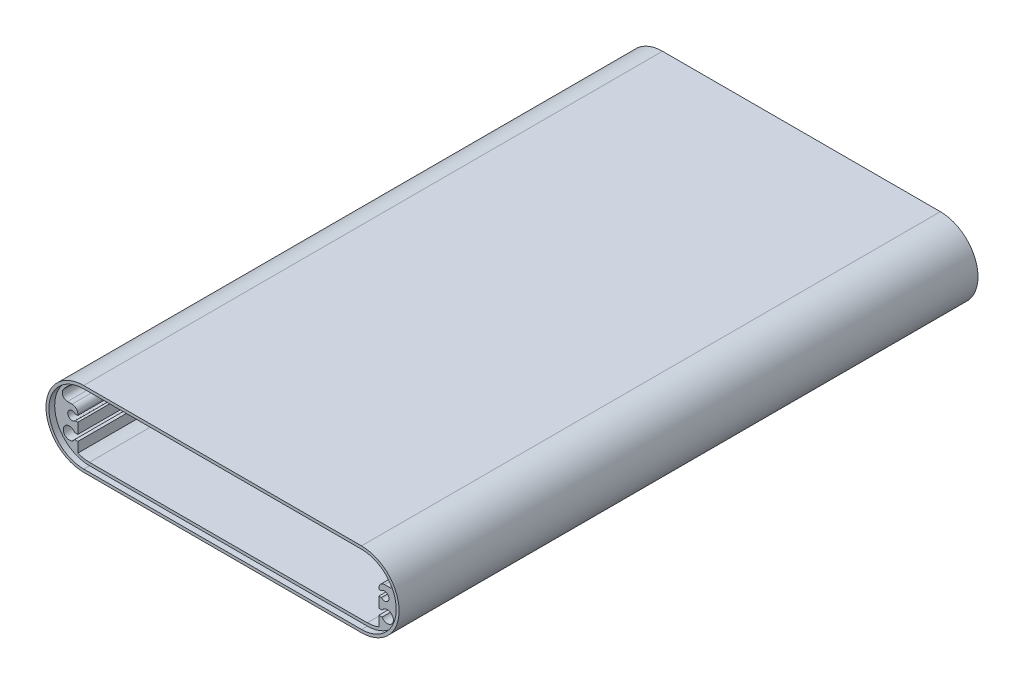
from build123d import *

# Parameters (mm, degrees)
BOSS_EXTRUDE1_DEPTH      = 50
BOSS_EXTRUDE1_DEPTH_BACK = 50
CUT_EXTRUDE1_DEPTH       = 1


with BuildPart() as part:
    # Sketch1 → Boss-Extrude1 (new, two sides: drawn at the far end of the back side and taken through both)
    with BuildSketch(Plane.XY.offset(-BOSS_EXTRUDE1_DEPTH_BACK)):
        with BuildLine():
            Line((24, 6.5), (-24, 6.5))
            ThreePointArc((-24, 6.5), (-30.5, 0), (-24, -6.5))
            Line((-24, -6.5), (24, -6.5))
            ThreePointArc((24, -6.5), (30.5, 0), (24, 6.5))
        make_face()
        with BuildLine():
            Line((24, 5.5), (-24, 5.5))
            ThreePointArc((-24, 5.5), (-26.564388223, 4.865584553), (-28.537180991, 3.108695652))
            ThreePointArc((-28.537180991, 3.108695652), (-28.590919755, 2.180372836), (-27.794733192, 1.7))
            Line((-27.794733192, 1.7), (-27, 1.7))
            ThreePointArc((-27, 1.7), (-26.292893219, 1.407106781), (-26, 0.7))
            Line((-26, 0.7), (-26, 0.5))
            Line((-26, 0.5), (-26.440983006, 0.5))
            ThreePointArc((-26.440983006, 0.5), (-27.75, 0), (-26.440983006, -0.5))
            Line((-26.440983006, -0.5), (-26, -0.5))
            Line((-26, -0.5), (-26, -2.325))
            Line((-26, -2.325), (-26.555673326, -2.325))
            ThreePointArc((-26.555673326, -2.325), (-28.515, -2.85), (-26.555673326, -3.375))
            Line((-26.555673326, -3.375), (-26, -3.375))
            Line((-26, -3.375), (-26, -5.123475383))
            ThreePointArc((-26, -5.123475383), (-25.017567048, -5.405049242), (-24, -5.5))
            Line((-24, -5.5), (24, -5.5))
            ThreePointArc((24, -5.5), (25.017567048, -5.405049242), (26, -5.123475383))
            Line((26, -5.123475383), (26, -3.375))
            Line((26, -3.375), (26.555673326, -3.375))
            ThreePointArc((26.555673326, -3.375), (28.515, -2.85), (26.555673326, -2.325))
            Line((26.555673326, -2.325), (26, -2.325))
            Line((26, -2.325), (26, -0.5))
            Line((26, -0.5), (26.440983006, -0.5))
            ThreePointArc((26.440983006, -0.5), (27.75, 0), (26.440983006, 0.5))
            Line((26.440983006, 0.5), (26, 0.5))
            Line((26, 0.5), (26, 0.7))
            ThreePointArc((26, 0.7), (26.292893219, 1.407106781), (27, 1.7))
            Line((27, 1.7), (27.794733192, 1.7))
            ThreePointArc((27.794733192, 1.7), (28.590919755, 2.180372836), (28.537180991, 3.108695652))
            ThreePointArc((28.537180991, 3.108695652), (26.564388223, 4.865584553), (24, 5.5))
        make_face(mode=Mode.SUBTRACT)
    extrude(amount=BOSS_EXTRUDE1_DEPTH + BOSS_EXTRUDE1_DEPTH_BACK)

    # Sketch2 → Cut-Extrude1 (cut)
    with BuildSketch(Plane.XY.offset(50)):
        with BuildLine():
            Line((24, 6), (-24, 6))
            ThreePointArc((-24, 6), (-30, 0), (-24, -6))
            Line((-24, -6), (24, -6))
            ThreePointArc((24, -6), (30, 0), (24, 6))
        make_face()
    cut_extrude1 = extrude(amount=-CUT_EXTRUDE1_DEPTH, mode=Mode.SUBTRACT)

    # Mirror1: Cut-Extrude1 across plane
    add(cut_extrude1.mirror(Plane.XY), mode=Mode.SUBTRACT)


solid = part.part
